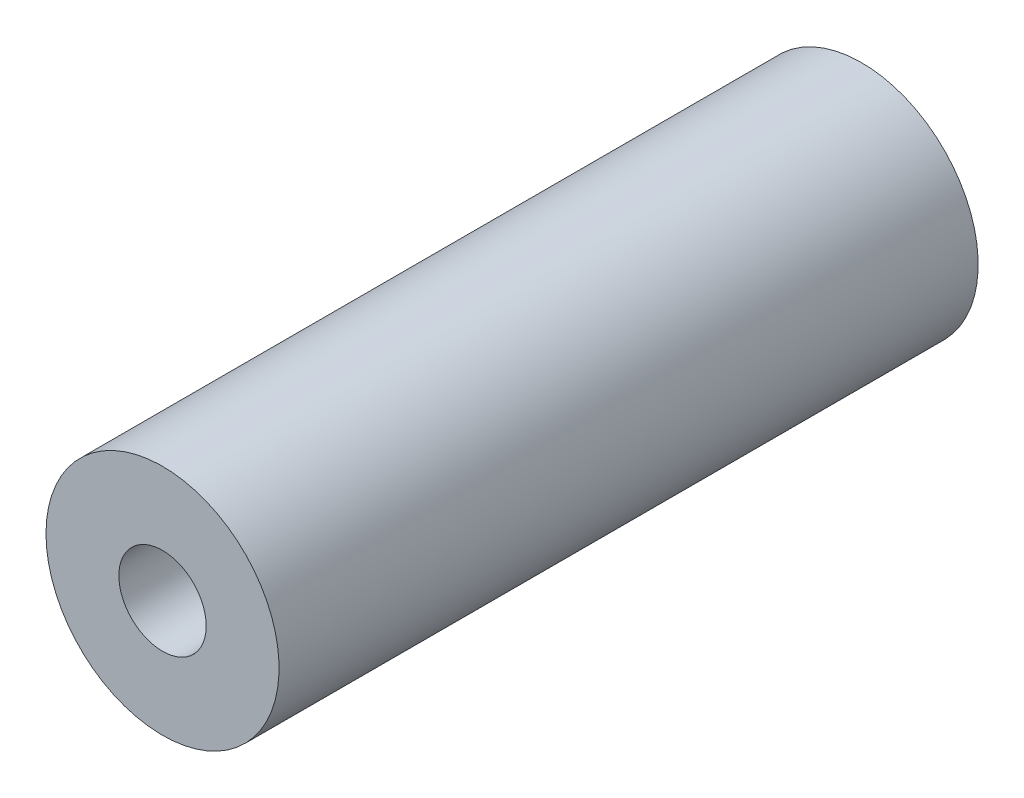
from build123d import *

# Parameters (mm, degrees)
SKETCH1_R           = 3.175
BOSS_EXTRUDE1_DEPTH = 19.05
SKETCH2_R           = 1.190625
CUT_EXTRUDE1_DEPTH  = 6.35


with BuildPart() as part:
    # Sketch1 → Boss-Extrude1 (new body)
    with BuildSketch(Plane.XY):
        with Locations(Location((0, 0, 0), (0, 0, 180))):
            Circle(SKETCH1_R)
    extrude(amount=BOSS_EXTRUDE1_DEPTH)

    # Sketch2 → Cut-Extrude1 (cut)
    with BuildSketch(Plane.XY.offset(19.05)):
        Circle(SKETCH2_R)
    extrude(amount=-CUT_EXTRUDE1_DEPTH, mode=Mode.SUBTRACT)


solid = part.part
